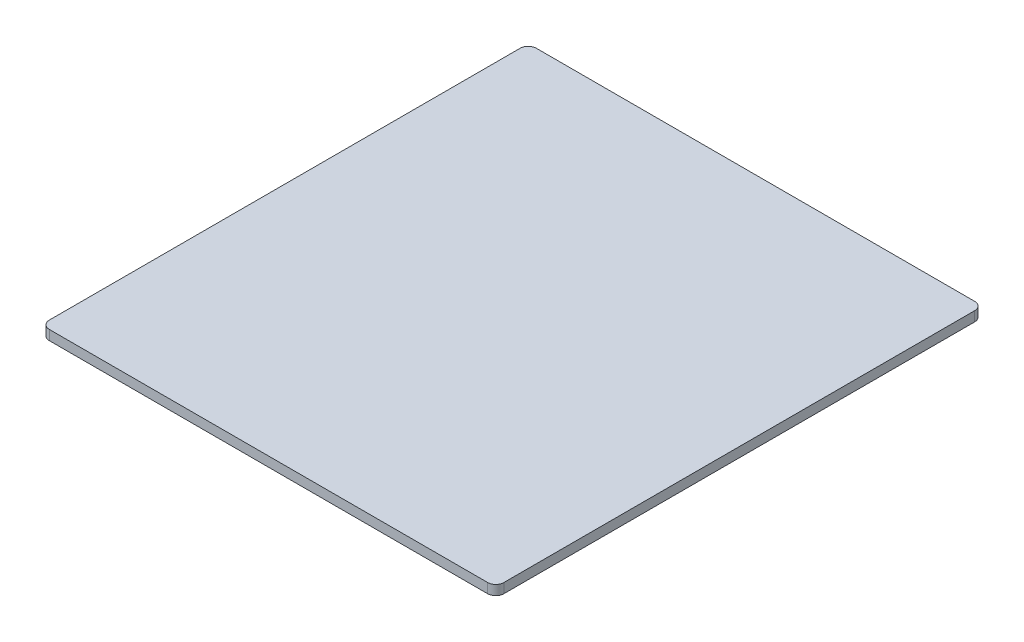
from build123d import *

# Parameters (mm, degrees)
SKETCH1_W           = 280
SKETCH1_H           = 300
BOSS_EXTRUDE1_DEPTH = 6
FILLET1_R           = 5
SKETCH2_R           = 3
CUT_EXTRUDE1_DEPTH  = 5
SKETCH3_R           = 3
CUT_EXTRUDE2_DEPTH  = 5


with BuildPart() as part:
    # Sketch1 → Boss-Extrude1 (new body)
    with BuildSketch(Plane(origin=(0, 0, 0), x_dir=(1, 0, 0), z_dir=(0, 1, 0))):
        Rectangle(SKETCH1_W, SKETCH1_H)
    extrude(amount=BOSS_EXTRUDE1_DEPTH)

    # Fillet1
    fillet1_edges = [part.edges().sort_by_distance(p)[0] for p in [
        (140, 3, 150),
        (-140, 3, 150),
        (-140, 3, -150),
        (140, 3, -150),
    ]]
    fillet(fillet1_edges, radius=FILLET1_R)

    # Sketch2 → Cut-Extrude1 (cut)
    with BuildSketch(Plane(origin=(0, 0, 0), x_dir=(-1, 0, 0), z_dir=(0, -1, 0))):
        with Locations(Location((0, 136.883397034, 0), (0, 0, 90))):
            Circle(SKETCH2_R)
        with Locations(Location((-35, 136.883397034, 0), (0, 0, 90))):
            Circle(SKETCH2_R)
        with Locations(Location((35.073494382, 136.883397034, 0), (0, 0, 90))):
            Circle(SKETCH2_R)
    extrude(amount=-CUT_EXTRUDE1_DEPTH, mode=Mode.SUBTRACT)

    # Sketch3 → Cut-Extrude2 (cut)
    with BuildSketch(Plane(origin=(0, 0, 0), x_dir=(-1, 0, 0), z_dir=(0, -1, 0))):
        with Locations(Location((103.5, 73, 0), (0, 0, 90))):
            Circle(SKETCH3_R)
        with Locations(Location((103.5, 87, 0), (0, 0, 90))):
            Circle(SKETCH3_R)
        with Locations(Location((-105.5, 73, 0), (0, 0, 90))):
            Circle(SKETCH3_R)
        with Locations(Location((-105.5, 87, 0), (0, 0, 90))):
            Circle(SKETCH3_R)
    extrude(amount=-CUT_EXTRUDE2_DEPTH, mode=Mode.SUBTRACT)


solid = part.part
